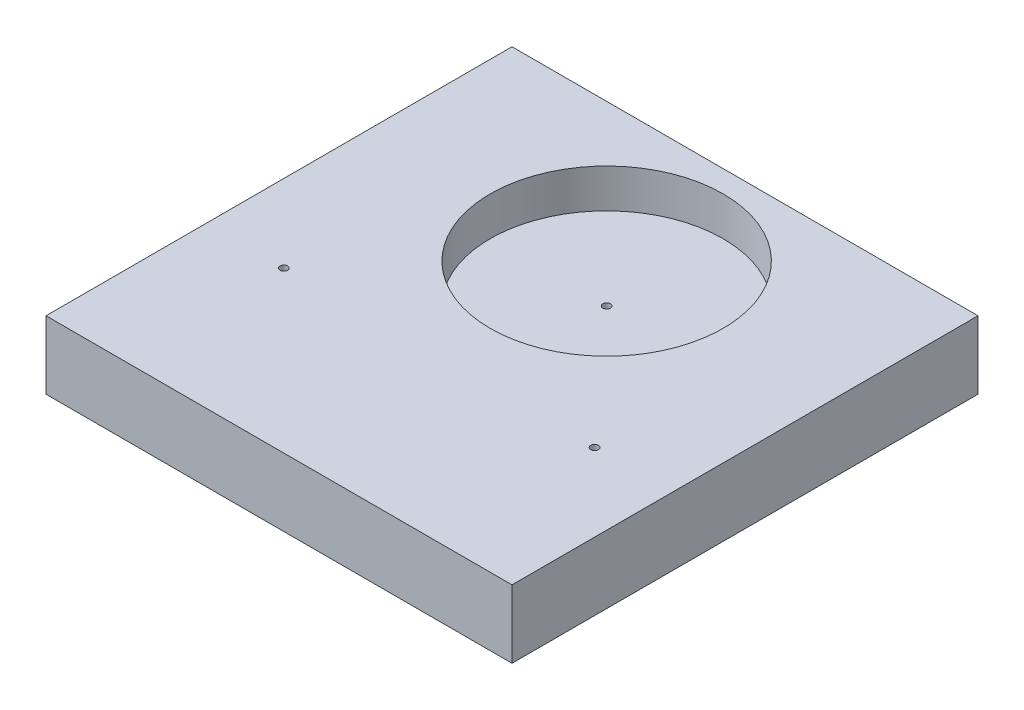
from build123d import *

# Parameters (mm, degrees)
SKETCH3_W                   = 152.4
SKETCH3_H                   = 22.225
BOSS_EXTRUDE1_DEPTH         = 76.2
M3_TAPPED_HOLE1_D           = 2.5
SKETCH10_R                  = 38.1
CUT_EXTRUDE3_DEPTH          = 12.7
M3_TAPPED_HOLE2_D           = 2.5
M3_TAPPED_HOLE2_CSINK_D     = 3.05
M3_TAPPED_HOLE2_CSINK_ANGLE = 90


with BuildPart() as part:
    # Sketch3 → Boss-Extrude1 (new, symmetric)
    with BuildSketch(Plane.XY):
        Rectangle(SKETCH3_W, SKETCH3_H)
    extrude(amount=BOSS_EXTRUDE1_DEPTH, both=True)

    # M3 Tapped Hole1 (through all)
    with Locations(Plane(origin=(0, -11.1125, 0), x_dir=(-1, 0, 0), z_dir=(0, -1, 0))):
        with Locations((-50.8, -23.8125), (50.8, -23.8125)):
            Hole(M3_TAPPED_HOLE1_D / 2)

    # Sketch10 → Cut-Extrude3 (cut)
    with BuildSketch(Plane(origin=(0, 11.1125, 0), x_dir=(1, 0, 0), z_dir=(0, 1, 0))):
        with Locations(Location((0, 30.95625, 0), (0, 0, 270))):
            Circle(SKETCH10_R)
    extrude(amount=-CUT_EXTRUDE3_DEPTH, mode=Mode.SUBTRACT)

    # M3 Tapped Hole2 (through all)
    with Locations(Plane(origin=(0, -11.1125, 0), x_dir=(-1, 0, 0), z_dir=(0, -1, 0))):
        with Locations((0, 30.95625)):
            CounterSinkHole(M3_TAPPED_HOLE2_D / 2, M3_TAPPED_HOLE2_CSINK_D / 2, counter_sink_angle=M3_TAPPED_HOLE2_CSINK_ANGLE)


solid = part.part
